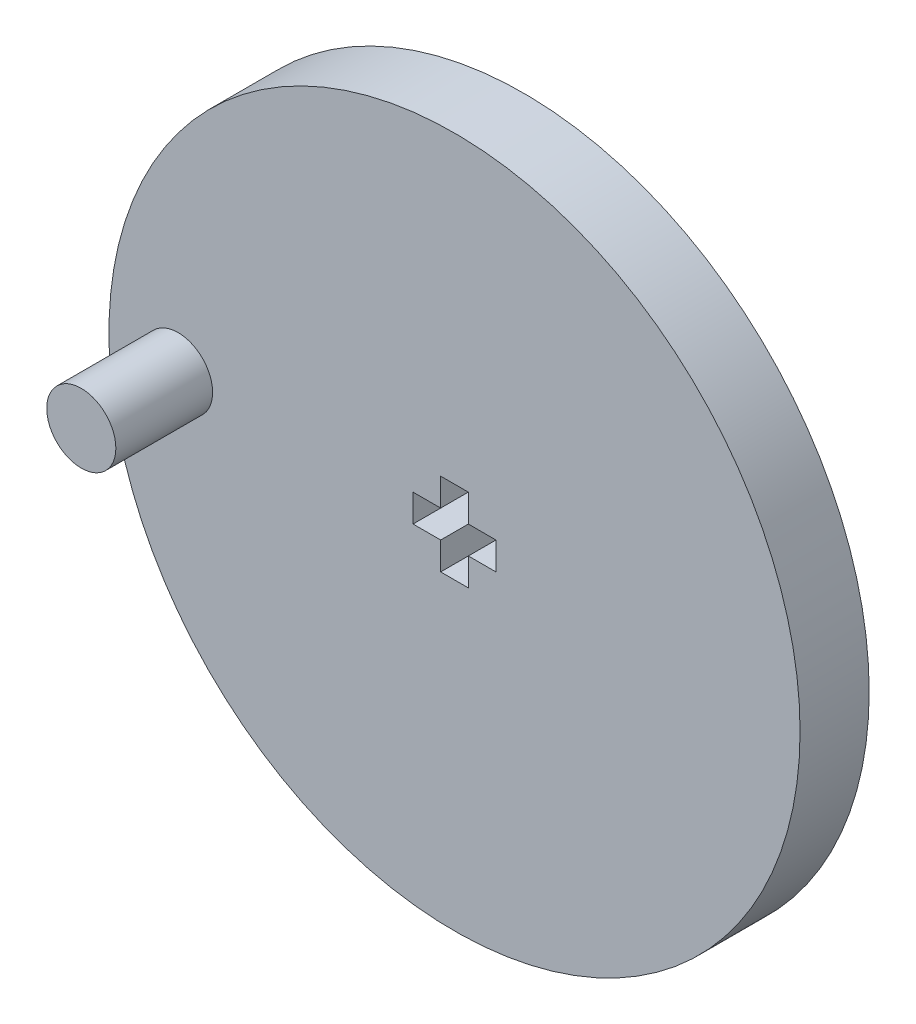
from build123d import *

# Parameters (mm, degrees)
SKETCH_1_R          = 25
EXTRUDE_1_DEPTH     = 5
SKETCH_2_R          = 2.5
EXTRUDE_2_DEPTH     = 7
SKETCH_3_W          = 2
SKETCH_3_H          = 2
CUT_EXTRUDE_1_DEPTH = 37.041642582


with BuildPart() as part:
    # 草图1 → 凸台-拉伸1 (new body)
    with BuildSketch(Plane.XY):
        Circle(SKETCH_1_R)
    extrude(amount=EXTRUDE_1_DEPTH)

    # 草图2 → 凸台-拉伸2 (add)
    with BuildSketch(Plane.XY.offset(5)):
        with Locations((-20, 0)):
            Circle(SKETCH_2_R)
    extrude(amount=EXTRUDE_2_DEPTH)

    # 草图3 → 切除-拉伸1 (cut, through all)
    with BuildSketch(Plane.XY.offset(5)):
        with Locations((0, 2)):
            Rectangle(SKETCH_3_W, SKETCH_3_H)
        with Locations((-2, 0)):
            Rectangle(SKETCH_3_W, SKETCH_3_H)
        with Locations((2, 0)):
            Rectangle(SKETCH_3_W, SKETCH_3_H)
        with Locations((0, -2)):
            Rectangle(SKETCH_3_W, SKETCH_3_H)
        Rectangle(SKETCH_3_W, SKETCH_3_H)
    extrude(amount=-CUT_EXTRUDE_1_DEPTH, mode=Mode.SUBTRACT)


solid = part.part
